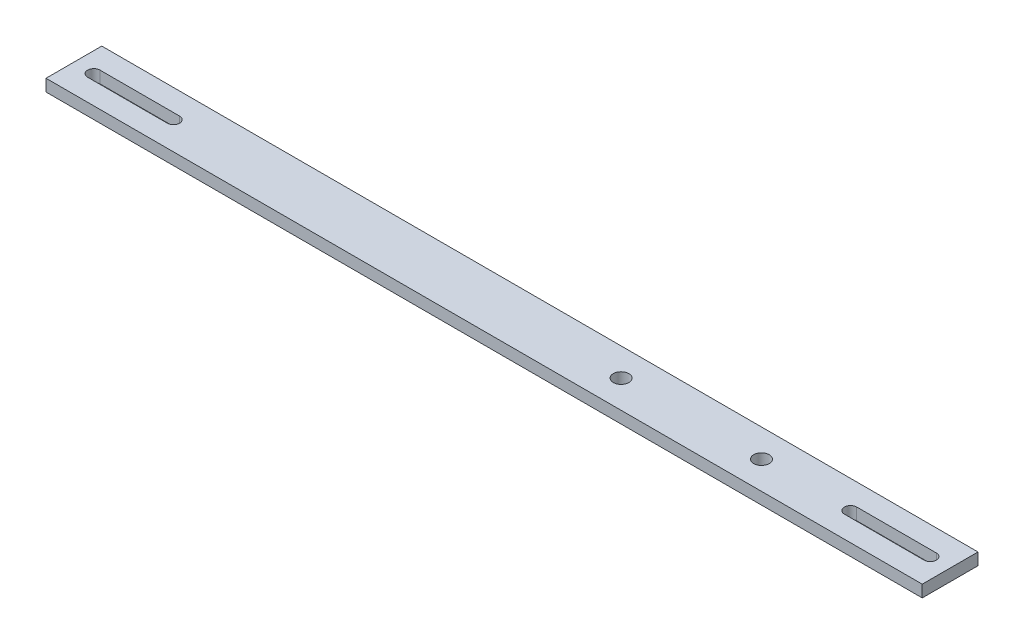
from build123d import *

# Parameters (mm, degrees)
SKIZZE1_W                       = 220
SKIZZE1_H                       = 14
AUFSATZ_LINEAR_AUSTRAGEN1_DEPTH = 3
SCHNITT_LINEAR_AUSTRAGEN1_DEPTH = 111.263321191
SCHNITT_LINEAR_AUSTRAGEN2_REACH = 112.263
SKIZZE3_R                       = 1.95


with BuildPart() as part:
    # Skizze1 → Aufsatz-Linear austragen1 (new body)
    with BuildSketch(Plane(origin=(0, 0, 0), x_dir=(1, 0, 0), z_dir=(0, 1, 0))):
        Rectangle(SKIZZE1_W, SKIZZE1_H)
    extrude(amount=AUFSATZ_LINEAR_AUSTRAGEN1_DEPTH)

    # Skizze2 → Schnitt-Linear austragen1 (cut, through all)
    with BuildSketch(Plane(origin=(0, 3, 0), x_dir=(1, 0, 0), z_dir=(0, 1, 0))):
        with BuildLine():
            Line((85, 1.55), (105, 1.55))
            ThreePointArc((105, 1.55), (106.55, 0), (105, -1.55))
            Line((105, -1.55), (85, -1.55))
            ThreePointArc((85, -1.55), (83.45, 0), (85, 1.55))
        make_face()
    schnitt_linear_austragen1 = extrude(amount=-SCHNITT_LINEAR_AUSTRAGEN1_DEPTH, mode=Mode.SUBTRACT)

    # Spiegeln1: Schnitt-Linear austragen1 across plane
    add(schnitt_linear_austragen1.mirror(Plane(origin=(0, 0, 0), x_dir=(0, 0, 1), z_dir=(1, 0, 0))), mode=Mode.SUBTRACT)

    # Skizze3 → Schnitt-Linear austragen2 (cut, up to next)
    with BuildSketch(Plane(origin=(0, 3, 0), x_dir=(1, 0, 0), z_dir=(0, 1, 0)), mode=Mode.PRIVATE) as schnitt_linear_austragen2_sk1:
        with Locations(Location((27.383, 0, 0), (0, 0, 270))):
            Circle(SKIZZE3_R)
    schnitt_linear_austragen2_tool1 = extrude(schnitt_linear_austragen2_sk1.sketch, amount=-SCHNITT_LINEAR_AUSTRAGEN2_REACH, mode=Mode.PRIVATE) & part.part
    # Skizze3 → Schnitt-Linear austragen2 (cut, up to next)
    with BuildSketch(Plane(origin=(0, 3, 0), x_dir=(1, 0, 0), z_dir=(0, 1, 0)), mode=Mode.PRIVATE) as schnitt_linear_austragen2_sk2:
        with Locations(Location((62.633, 0, 0), (0, 0, 270))):
            Circle(SKIZZE3_R)
    schnitt_linear_austragen2_tool2 = extrude(schnitt_linear_austragen2_sk2.sketch, amount=-SCHNITT_LINEAR_AUSTRAGEN2_REACH, mode=Mode.PRIVATE) & part.part
    add(schnitt_linear_austragen2_tool1.solids().sort_by_distance((27.383, 3, 0))[0], mode=Mode.SUBTRACT)
    add(schnitt_linear_austragen2_tool2.solids().sort_by_distance((62.633, 3, 0))[0], mode=Mode.SUBTRACT)


solid = part.part
